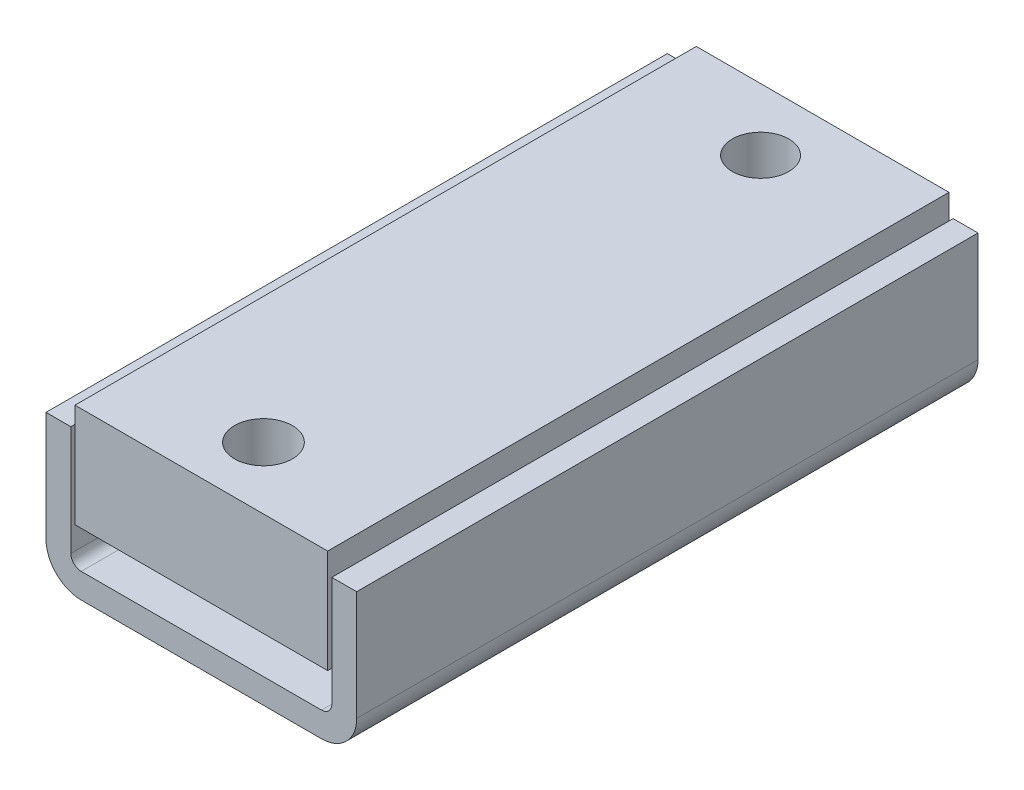
from build123d import *

# Parameters (mm, degrees)
BOSS_EXTRU_1_DEPTH      = 30
ESQUISSE2_R             = 1.5
ENL_V_MAT_EXTRU_1_DEPTH = 35.263683398
CONG_1_R                = 0.5
CONG_2_R                = 1.7
ESQUISSE3_W             = 12.2
ESQUISSE3_H             = 5
BOSS_EXTRU_2_DEPTH      = 30
ESQUISSE4_R             = 1.364491204
ESQUISSE4_R_2           = 1.396559876
ENL_V_MAT_EXTRU_2_DEPTH = 5


with BuildPart() as part:
    # Esquisse1 → Boss.-Extru.1 (new body)
    with BuildSketch(Plane.XY):
        Polygon((0, 7), (0, 0), (15, 0), (15, 7), (13.8, 7), (13.8, 1.2), (1.2, 1.2), (1.2, 7), align=None)
    extrude(amount=BOSS_EXTRU_1_DEPTH)

    # Esquisse2 → Enlèv. mat.-Extru.1 (cut, through all)
    with BuildSketch(Plane.XZ):
        with Locations(Location((7.5, 22, 0), (0, 0, 270))):
            Circle(ESQUISSE2_R)
        with Locations(Location((7.5, 8, 0), (0, 0, 270))):
            Circle(ESQUISSE2_R)
    extrude(amount=-ENL_V_MAT_EXTRU_1_DEPTH, mode=Mode.SUBTRACT)

    # Congé1
    cong_1_edges = [part.edges().sort_by_distance(p)[0] for p in [
        (1.2, 1.2, 15),
        (13.8, 1.2, 15),
    ]]
    fillet(cong_1_edges, radius=CONG_1_R)

    # Congé2
    cong_2_edges = [part.edges().sort_by_distance(p)[0] for p in [
        (15, 0, 15),
        (0, 0, 15),
    ]]
    fillet(cong_2_edges, radius=CONG_2_R)


with BuildPart() as body_2:
    # Esquisse3 → Boss.-Extru.2 (new body)
    with BuildSketch(Plane.XY.offset(30)):
        with Locations((7.5, 5.5)):
            Rectangle(ESQUISSE3_W, ESQUISSE3_H)
    extrude(amount=-BOSS_EXTRU_2_DEPTH)

    # Esquisse4 → Enlèv. mat.-Extru.2 (cut)
    with BuildSketch(Plane(origin=(0, 8, 0), x_dir=(1, 0, 0), z_dir=(0, 1, 0))):
        with Locations(Location((7.5, -3, 0), (0, 0, 180))):
            Circle(ESQUISSE4_R)
        with Locations(Location((7.5, -27, 0), (0, 0, 180))):
            Circle(ESQUISSE4_R_2)
    extrude(amount=-ENL_V_MAT_EXTRU_2_DEPTH, mode=Mode.SUBTRACT)


solid = Compound([part.part, body_2.part])
